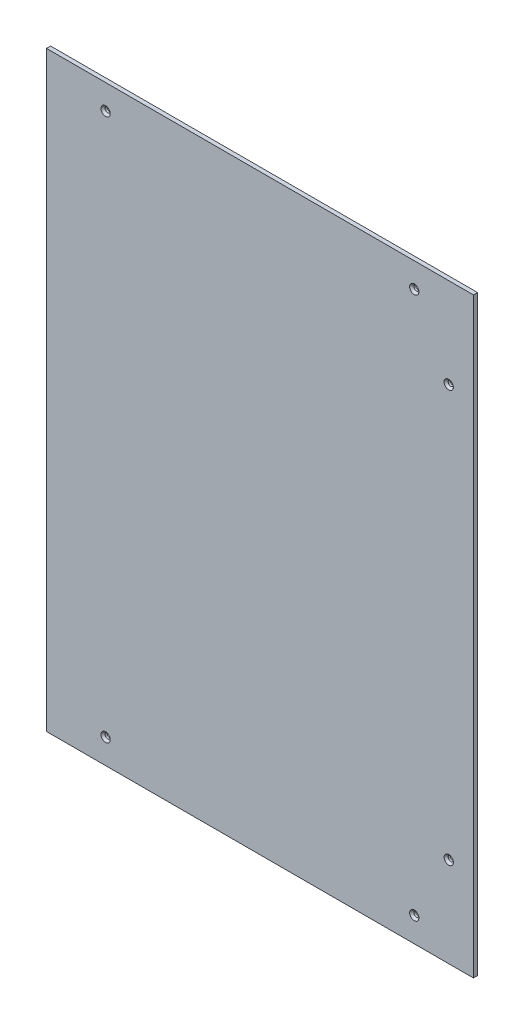
from build123d import *

# Parameters (mm, degrees)
ESQUISSE1_W             = 415
ESQUISSE1_H             = 575
BOSS_EXTRU_1_DEPTH      = 2
ESQUISSE2_R             = 2.5
ENL_V_MAT_EXTRU_1_DEPTH = 355.582148451
CHANFREIN1_SIZE         = 2


with BuildPart() as part:
    # Esquisse1 → Boss.-Extru.1 (new, symmetric)
    with BuildSketch(Plane.XY):
        Rectangle(ESQUISSE1_W, ESQUISSE1_H)
    extrude(amount=BOSS_EXTRU_1_DEPTH, both=True)

    # Esquisse2 → Enlèv. mat.-Extru.1 (cut, through all)
    with BuildSketch(Plane.XY.offset(2)):
        with Locations((-150, -263.5)):
            Circle(ESQUISSE2_R)
        with Locations((150, -263.5)):
            Circle(ESQUISSE2_R)
        with Locations((183.5, -200)):
            Circle(ESQUISSE2_R)
        with Locations((183.5, 200)):
            Circle(ESQUISSE2_R)
        with Locations((-150, 263.5)):
            Circle(ESQUISSE2_R)
        with Locations((150, 263.5)):
            Circle(ESQUISSE2_R)
    extrude(amount=-ENL_V_MAT_EXTRU_1_DEPTH, mode=Mode.SUBTRACT)

    # Chanfrein1
    chanfrein1_edges = [part.edges().sort_by_distance(p)[0] for p in [
        (147.5, -263.5, 2),
        (181, -200, 2),
        (181, 200, 2),
        (-152.5, 263.5, 2),
        (147.5, 263.5, 2),
        (-152.5, -263.5, 2),
    ]]
    chamfer(chanfrein1_edges, length=CHANFREIN1_SIZE)


solid = part.part
